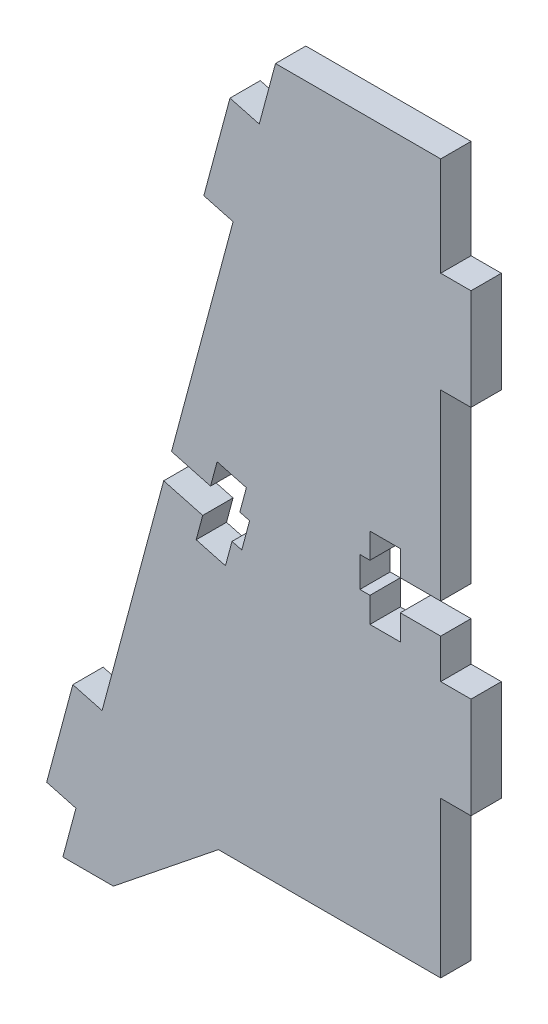
from build123d import *

# Parameters (mm, degrees)
SALIENTE_EXTRUIR1_DEPTH = 1.5


with BuildPart() as part:
    # Croquis1 → Saliente-Extruir1 (new, symmetric)
    with BuildSketch(Plane.XY):
        Polygon((484.855720511, 82.973038085), (491.215178715, 82.973038085), (501.205555648, 82.973038085), (501.205555648, 73.173108985), (504.205555648, 73.173108985), (504.205555648, 63.173108985), (501.205555648, 63.173108985), (501.205555648, 45.073108985), (497.205555648, 45.073108985), (497.205555648, 47.573108985), (494.205555648, 47.573108985), (494.205555648, 45.073108985), (493.205555648, 45.073108985), (493.205555648, 42.073108985), (494.205555648, 42.073108985), (494.205555648, 39.573108985), (497.205555648, 39.573108985), (497.205555648, 42.073108985), (501.205555648, 42.073108985), (501.205555648, 38.173108985), (504.205555648, 38.173108985), (504.205555648, 28.173108985), (501.205555648, 28.173108985), (501.205555648, 12.773108985), (494.855720505, 12.773108985), (479.205555648, 12.773108985), (468.814796849, 4.447241951), (463.814796852, 4.447241951), (465.108892077, 9.276871079), (462.2111146, 10.053328214), (464.799305049, 19.712586471), (467.697082526, 18.936129336), (473.790976943, 41.678852916), (477.654680248, 40.643576736), (477.007632636, 38.22876217), (479.905410114, 37.452305035), (480.552457727, 39.867119601), (481.518383553, 39.608300556), (482.294840689, 42.506078034), (481.328914862, 42.764897079), (481.975962475, 45.179711645), (479.078184996, 45.956168781), (478.431137384, 43.541354215), (474.567434078, 44.576630395), (480.661787289, 67.321066215), (477.764009811, 68.097523349), (480.352200261, 77.756781606), (483.249977738, 76.980324471), align=None)
    extrude(amount=SALIENTE_EXTRUIR1_DEPTH, both=True)


solid = part.part
